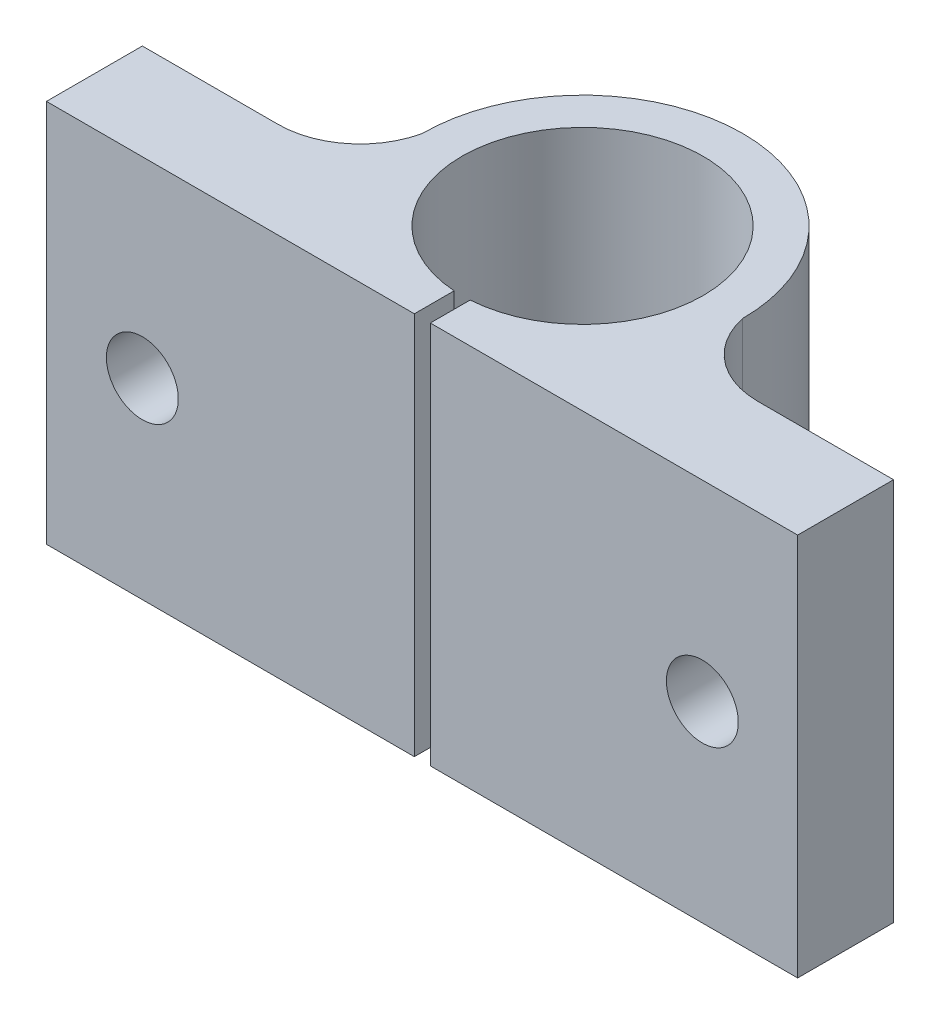
from build123d import *

# Parameters (mm, degrees)
BOSS_EXTRUDE1_DEPTH        = 24
CUT_EXTRUDE1_DEPTH         = 57.451924465
SKETCH3_W                  = 7.55
SKETCH3_H                  = 24
F_4_5_4_5_DIAMETER_HOLE1_D = 4.5


with BuildPart() as part:
    # Sketch1 → Boss-Extrude1 (new body)
    with BuildSketch(Plane(origin=(0, 24, 0), x_dir=(1, 0, 0), z_dir=(0, 1, 0))):
        with BuildLine():
            Line((0, 0), (47, 0))
            Line((47, 0), (47, 6))
            Line((47, 6), (38.5, 6))
            ThreePointArc((38.5, 6), (35.307693119, 7.131854655), (33.541354656, 10.021831577))
            ThreePointArc((33.541354656, 10.021831577), (23.505747016, 20.045434485), (13.49594739, 9.996059012))
            ThreePointArc((13.49594739, 9.996059012), (11.698748894, 7.121907302), (8.5, 6))
            Line((8.5, 6), (0, 6))
            Line((0, 6), (0, 0))
        make_face()
    extrude(amount=-BOSS_EXTRUDE1_DEPTH)

    # Sketch2 → Cut-Extrude1 (cut, through all)
    with BuildSketch(Plane.XZ):
        with BuildLine():
            Line((24.018633311, 0), (23.018633311, 0))
            Line((23.018633311, 0), (23.018633311, -2.489295869))
            ThreePointArc((23.018633311, -2.489295869), (23.518633311, -2.472721384), (24.018633311, -2.489295869))
            Line((24.018633311, -2.489295869), (24.018633311, 0))
        make_face()
    extrude(amount=-CUT_EXTRUDE1_DEPTH, mode=Mode.SUBTRACT)

    # Sketch3 → Cut-Revolve1 (revolve, cut)
    with BuildSketch(Plane(origin=(0, 0, -10.022721384), x_dir=(-1, 0, 0), z_dir=(0, 0, -1))):
        with Locations((-27.293633311, 12)):
            Rectangle(SKETCH3_W, SKETCH3_H)
    revolve(axis=Axis((23.518633311, 0, -10.022721384), (0, 1, 0)), mode=Mode.SUBTRACT)

    # Ø4.5 (4.5) Diameter Hole1 (through all)
    with Locations(Plane(origin=(0, 0, -6), x_dir=(-1, 0, 0), z_dir=(0, 0, -1))):
        with Locations((-41.037266621, 12), (-6, 12)):
            Hole(F_4_5_4_5_DIAMETER_HOLE1_D / 2)


solid = part.part
